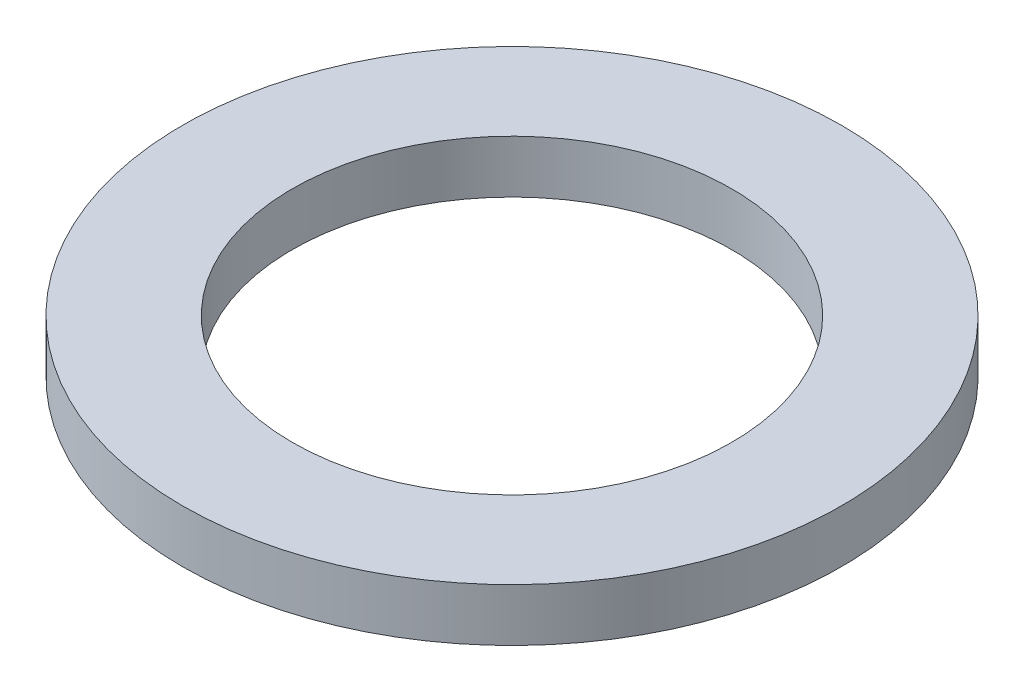
from build123d import *

# Parameters (mm, degrees)
SKETCH1_R           = 9.525
BOSS_EXTRUDE1_DEPTH = 1.524
SKETCH5_R           = 6.35
CUT_EXTRUDE1_DEPTH  = 14.556320518


with BuildPart() as part:
    # Sketch1 → Boss-Extrude1 (new body)
    with BuildSketch(Plane(origin=(0, 0, 0), x_dir=(1, 0, 0), z_dir=(0, 1, 0))):
        with Locations(Location((0, 0, 0), (0, 0, 90))):
            Circle(SKETCH1_R)
    extrude(amount=BOSS_EXTRUDE1_DEPTH)

    # Sketch5 → Cut-Extrude1 (cut, through all)
    with BuildSketch(Plane(origin=(0, 1.524, 0), x_dir=(-1, 0, 0), z_dir=(0, 1, 0))):
        with Locations(Location((0, 0, 0), (0, 0, 90))):
            Circle(SKETCH5_R)
    extrude(amount=-CUT_EXTRUDE1_DEPTH, mode=Mode.SUBTRACT)


solid = part.part
